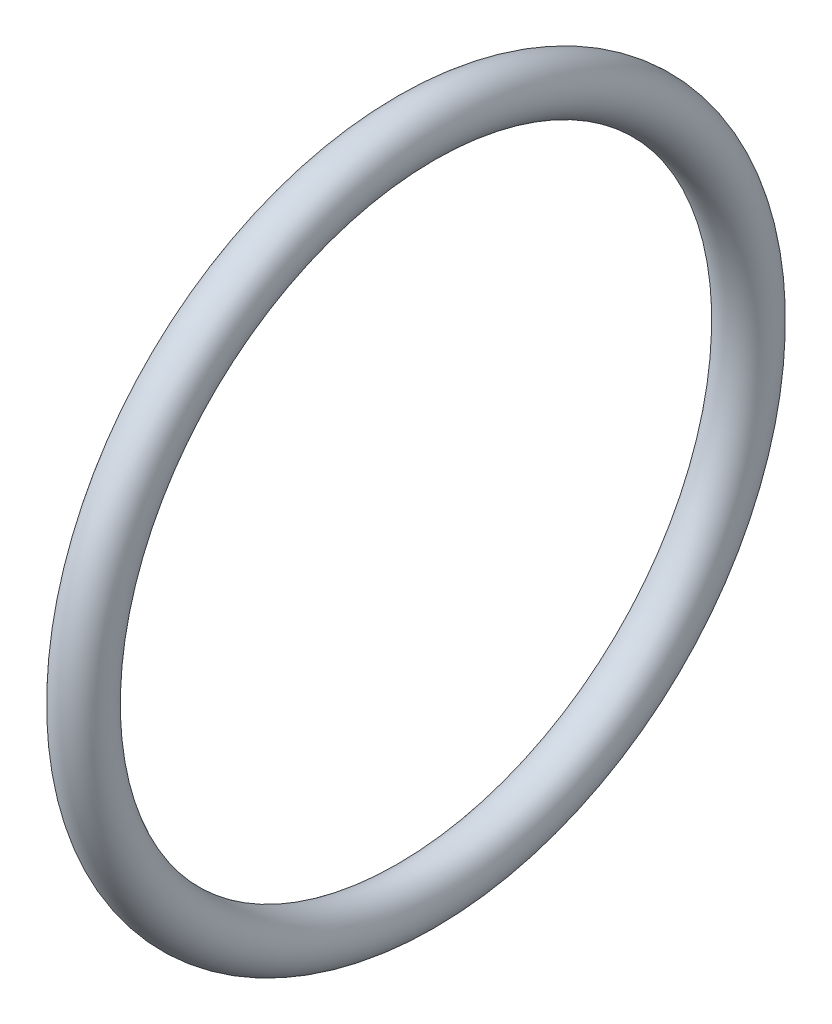
from build123d import *

# Parameters (mm, degrees)
SKETCH_1_R = 2


with BuildPart() as part:
    # Эскиз1 → Повернуть1 (revolve)
    with BuildSketch(Plane.XY):
        with Locations((0, 25.5)):
            Circle(SKETCH_1_R)
    revolve(axis=Axis((0, 0, 0), (-1, 0, 0)))


solid = part.part
